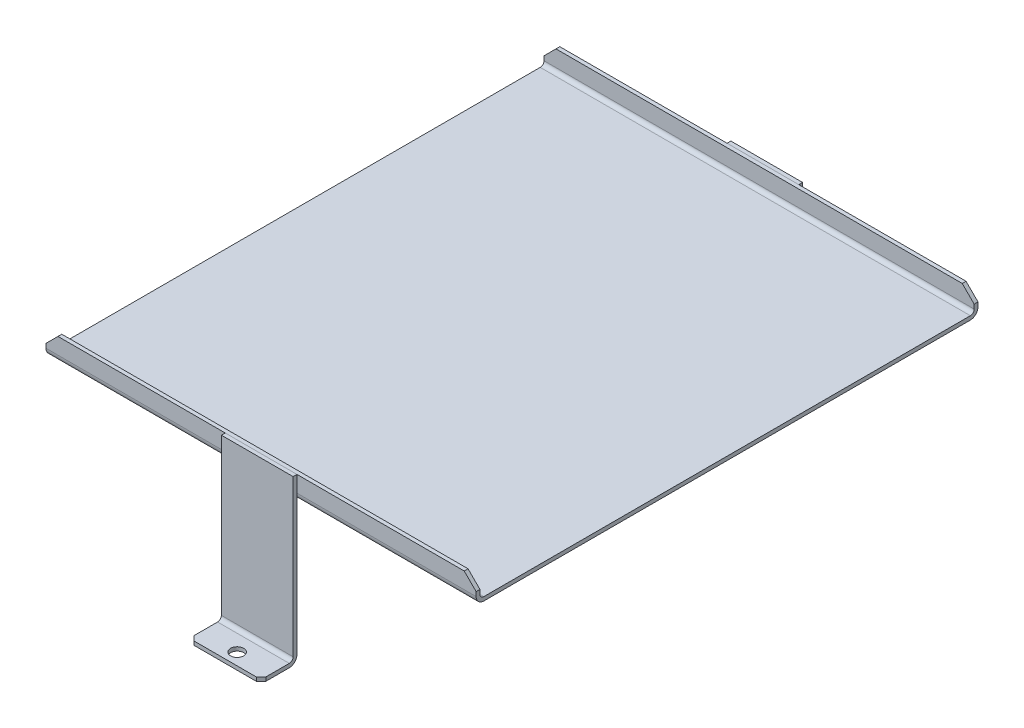
from build123d import *

# Parameters (mm, degrees)
BOSS_EXTRUDE1_DEPTH           = 15
FILLET1_R                     = 1.6
FILLET2_R                     = 3.2
CHAMFER1_SIZE                 = 2
SKETCH2_W                     = 180
SKETCH2_H                     = 10
CUT_EXTRUDE1_DEPTH            = 105
SHELL1_T                      = -1.6
FILLET3_R                     = 1.6
FILLET4_R                     = 3.2
CHAMFER2_SIZE                 = 5
SKETCH4_W                     = 2.75
SKETCH4_H                     = 1.6
M5_CLEARANCE_HOLE1_AT_2_COUNT = 2
M5_CLEARANCE_HOLE1_AT_2_PITCH = 230


with BuildPart() as part:
    # Sketch1 → Boss-Extrude1 (new, symmetric)
    with BuildSketch(Plane(origin=(0, 0, 0), x_dir=(0, 0, -1), z_dir=(1, 0, 0))):
        Polygon((-120, 0), (-105, 0), (-105, 68.5), (-106.6, 68.5), (-106.6, 1.6), (-120, 1.6), align=None)
    extrude(amount=BOSS_EXTRUDE1_DEPTH, both=True)

    # Fillet1
    fillet1_edges = [part.edges().sort_by_distance(p)[0] for p in [
        (0, 1.6, 106.6),
    ]]
    fillet(fillet1_edges, radius=FILLET1_R)

    # Fillet2
    fillet2_edges = [part.edges().sort_by_distance(p)[0] for p in [
        (0, 0, 105),
    ]]
    fillet(fillet2_edges, radius=FILLET2_R)

    # Chamfer1
    chamfer1_edges = [part.edges().sort_by_distance(p)[0] for p in [
        (15, 0.8, 120),
        (-15, 0.8, 120),
    ]]
    chamfer(chamfer1_edges, length=CHAMFER1_SIZE)


with BuildPart() as body_2:
    # Sketch2 → Cut-Extrude1 (new, symmetric)
    with BuildSketch(Plane.XY):
        with Locations((0, 63.5)):
            Rectangle(SKETCH2_W, SKETCH2_H)
    extrude(amount=CUT_EXTRUDE1_DEPTH, both=True)

    # Shell1
    shell1_openings = [body_2.faces().sort_by_distance(p)[0] for p in [
        (0, 68.5, 0),
        (90, 63.5, 0),
        (-90, 63.5, 0),
    ]]
    offset(amount=SHELL1_T, openings=shell1_openings, kind=Kind.INTERSECTION)

    # Fillet3
    fillet3_edges = [body_2.edges().sort_by_distance(p)[0] for p in [
        (0, 60.1, -103.4),
        (0, 60.1, 103.4),
    ]]
    fillet(fillet3_edges, radius=FILLET3_R)

    # Fillet4
    fillet4_edges = [body_2.edges().sort_by_distance(p)[0] for p in [
        (0, 58.5, -105),
        (0, 58.5, 105),
    ]]
    fillet(fillet4_edges, radius=FILLET4_R)

    # Chamfer2
    chamfer2_edges = [body_2.edges().sort_by_distance(p)[0] for p in [
        (-90, 68.5, -104.2),
        (90, 68.5, -104.2),
        (-90, 68.5, 104.2),
        (90, 68.5, 104.2),
    ]]
    chamfer(chamfer2_edges, length=CHAMFER2_SIZE)


with BuildPart() as body_3:
    # MirrorSolid1: mirrored copy
    add(part.part.mirror(Plane.XY))


with BuildPart() as part_1:
    add(part.part)

    # Sketch4 → M5 Clearance Hole1 (revolve, cut)
    with BuildSketch(Plane(origin=(0, 1.6, 115), x_dir=(0, 0, 1), z_dir=(1, 0, 0))):
        with Locations((1.375, 0.8)):
            Rectangle(SKETCH4_W, SKETCH4_H)
    m5_clearance_hole1 = revolve(axis=Axis((0, 7.95, 115), (0, -1, 0)), mode=Mode.SUBTRACT)


with BuildPart() as body_3_1:
    add(body_3.part)

    # M5 Clearance Hole1 at 2: M5 Clearance Hole1 ×2
    with Locations(*[(0, 0, -i * M5_CLEARANCE_HOLE1_AT_2_PITCH) for i in range(1, M5_CLEARANCE_HOLE1_AT_2_COUNT)]):
        add(m5_clearance_hole1, mode=Mode.SUBTRACT)


solid = Compound([body_2.part, part_1.part, body_3_1.part])
